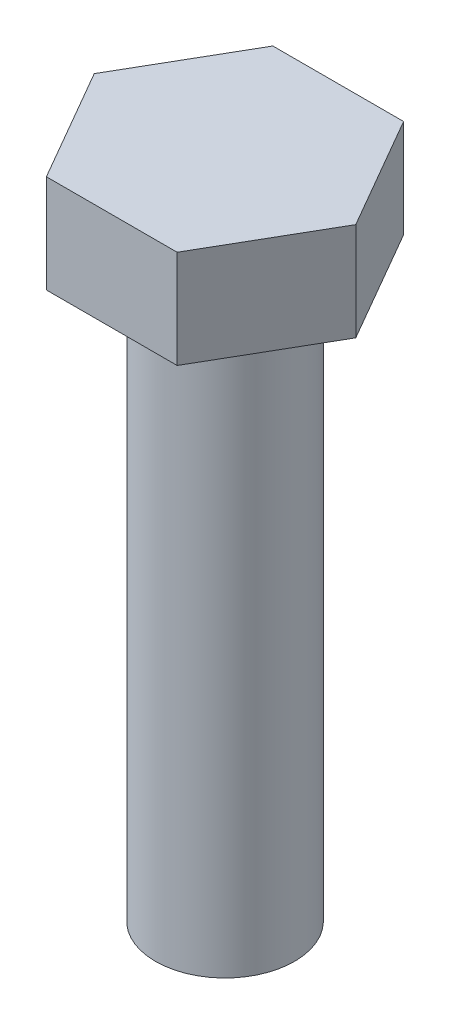
from build123d import *

# Parameters (mm, degrees)
BOSS_EXTRUDE1_DEPTH = 5.5
BOSS_EXTRUDE2_START = -32
SKETCH2_R           = 3.9
BOSS_EXTRUDE2_DEPTH = 32


with BuildPart() as part:
    # Sketch1 → Boss-Extrude1 (new body)
    with BuildSketch(Plane(origin=(0, 0, 0), x_dir=(1, 0, 0), z_dir=(0, 1, 0))):
        Polygon((7.332348419, 0), (3.666174209, 6.35), (-3.666174209, 6.35), (-7.332348419, 0), (-3.666174209, -6.35), (3.666174209, -6.35), align=None)
    extrude(amount=BOSS_EXTRUDE1_DEPTH)

    # Sketch2 → Boss-Extrude2 (add)
    with BuildSketch(Plane(origin=(0, 0, 0), x_dir=(1, 0, 0), z_dir=(0, 1, 0)).offset(BOSS_EXTRUDE2_START)):
        with Locations(Location((0, 0, 0), (0, 0, 270))):
            Circle(SKETCH2_R)
    extrude(amount=BOSS_EXTRUDE2_DEPTH)


solid = part.part
